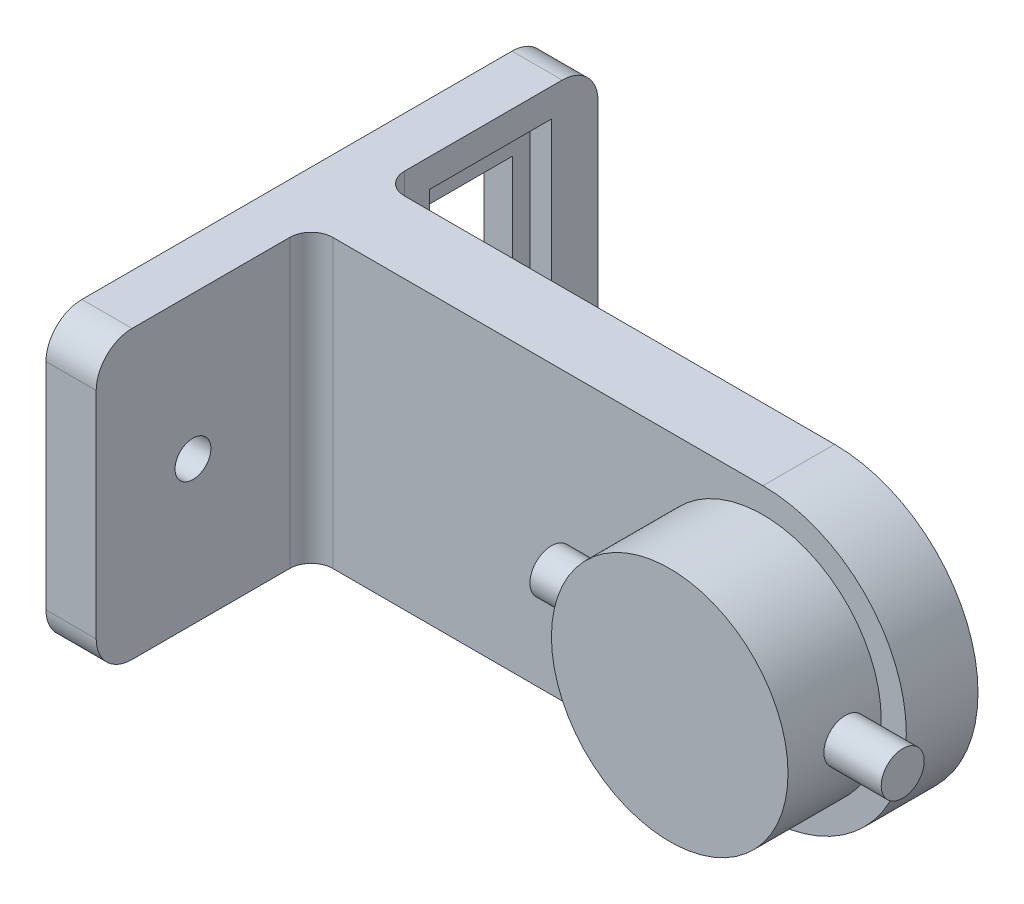
from build123d import *

# Parameters (mm, degrees)
BOSS_EXTRUDE1_DEPTH      = 10
BOSS_EXTRUDE2_DEPTH      = 30
BOSS_EXTRUDE2_DEPTH_BACK = 40
SKETCH2_W                = 7
SKETCH2_H                = 40
SKETCH3_R                = 16.5
BOSS_EXTRUDE3_DEPTH      = 13
SKETCH4_W                = 12.15
SKETCH4_H                = 22.55
CUT_EXTRUDE1_DEPTH       = 10
SKETCH4_3_W              = 17
SKETCH4_3_H              = 32.1
CUT_EXTRUDE2_DEPTH       = 3
FILLET1_R                = 3
FILLET2_R                = 5
SKETCH5_R                = 3
BOSS_EXTRUDE4_DEPTH      = 8
CIRPATTERN3_COUNT        = 2
CIRPATTERN3_ANGLE        = 180
SKETCH6_R                = 2.5
CUT_EXTRUDE3_DEPTH       = 7


with BuildPart() as part:
    # Sketch1 → Boss-Extrude1 (new body)
    with BuildSketch(Plane.XY):
        with BuildLine():
            Line((-45, 20), (25, 20))
            ThreePointArc((25, 20), (45, 0), (25, -20))
            Line((25, -20), (-45, -20))
            Line((-45, -20), (-45, 20))
        make_face()
    extrude(amount=BOSS_EXTRUDE1_DEPTH)

    # Sketch2 → Boss-Extrude2 (add, two sides: drawn at the far end of the back side and taken through both)
    with BuildSketch(Plane(origin=(0, 0, 0), x_dir=(-1, 0, 0), z_dir=(0, 0, -1)).offset(-BOSS_EXTRUDE2_DEPTH_BACK)):
        with Locations((41.5, 0)):
            Rectangle(SKETCH2_W, SKETCH2_H)
    extrude(amount=BOSS_EXTRUDE2_DEPTH + BOSS_EXTRUDE2_DEPTH_BACK)

    # Sketch3 → Boss-Extrude3 (add)
    with BuildSketch(Plane.XY.offset(10)):
        with Locations((25, 0)):
            Circle(SKETCH3_R)
    extrude(amount=BOSS_EXTRUDE3_DEPTH)

    # Sketch4 → Cut-Extrude1 (cut)
    with BuildSketch(Plane(origin=(-38, 0, 0), x_dir=(0, 0, -1), z_dir=(1, 0, 0))):
        with Locations((15, 0)):
            Rectangle(SKETCH4_W, SKETCH4_H)
    extrude(amount=-CUT_EXTRUDE1_DEPTH, mode=Mode.SUBTRACT)

    # Sketch4<3> → Cut-Extrude2 (cut)
    with BuildSketch(Plane(origin=(-38, 0, 0), x_dir=(0, 0, -1), z_dir=(1, 0, 0))):
        with Locations((15, 0)):
            Rectangle(SKETCH4_3_W, SKETCH4_3_H)
    extrude(amount=-CUT_EXTRUDE2_DEPTH, mode=Mode.SUBTRACT)

    # Fillet1
    fillet1_edges = [part.edges().sort_by_distance(p)[0] for p in [
        (-38, 0, 10),
        (-38, 0, 0),
    ]]
    fillet(fillet1_edges, radius=FILLET1_R)

    # Fillet2
    fillet2_edges = [part.edges().sort_by_distance(p)[0] for p in [
        (-41.5, -20, 40),
        (-41.5, 20, 40),
        (-41.5, -20, -30),
        (-41.5, 20, -30),
    ]]
    fillet(fillet2_edges, radius=FILLET2_R)

    # Sketch6 → Cut-Extrude3 (cut)
    with BuildSketch(Plane(origin=(-38, 0, 0), x_dir=(0, 0, -1), z_dir=(1, 0, 0))):
        with Locations((-26.5, 0)):
            Circle(SKETCH6_R)
    extrude(amount=-CUT_EXTRUDE3_DEPTH, mode=Mode.SUBTRACT)


with BuildPart() as body_2:
    # Sketch5 → Boss-Extrude4 (new body)
    with BuildSketch(Plane(origin=(41.5, 0, 0), x_dir=(0, 0, -1), z_dir=(1, 0, 0))):
        with Locations((-15, 0)):
            Circle(SKETCH5_R)
    extrude(amount=BOSS_EXTRUDE4_DEPTH)


with BuildPart() as cirpattern3_1:
    # CirPattern3: pattern copy
    add(body_2.part.rotate(Axis((25, 0, 23), (0, 0, -1)), 1 * CIRPATTERN3_ANGLE / (CIRPATTERN3_COUNT - 1)))


solid = Compound([part.part, body_2.part, cirpattern3_1.part])
